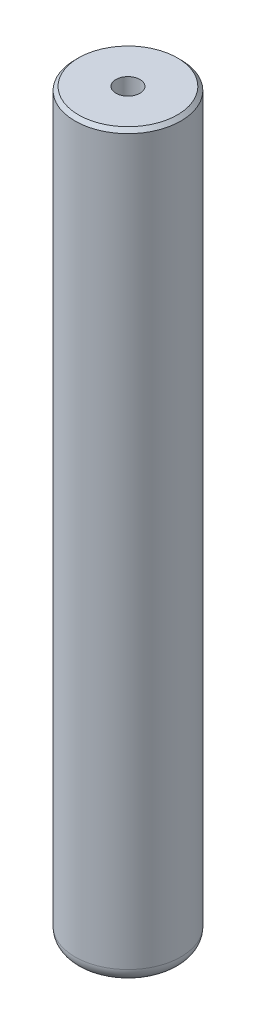
from build123d import *

# Parameters (mm, degrees)
SKETCH1_R                  = 15
BOSS_EXTRUDE1_DEPTH        = 210
FILLET1_R                  = 4
CHAMFER1_SIZE              = 1
M8X1_25_TAPPED_HOLE1_D     = 6.8
M8X1_25_TAPPED_HOLE1_DEPTH = 19.75
M8X1_25_TAPPED_HOLE1_TIP   = 2.042926105


with BuildPart() as part:
    # Sketch1 → Boss-Extrude1 (new body)
    with BuildSketch(Plane(origin=(0, 0, 0), x_dir=(1, 0, 0), z_dir=(0, 1, 0))):
        with Locations(Location((0, 0, 0), (0, 0, 270))):
            Circle(SKETCH1_R)
    extrude(amount=BOSS_EXTRUDE1_DEPTH)

    # Fillet1
    fillet1_edges = [part.edges().sort_by_distance(p)[0] for p in [
        (0, 0, -15),
    ]]
    fillet(fillet1_edges, radius=FILLET1_R)

    # Chamfer1
    chamfer1_edges = [part.edges().sort_by_distance(p)[0] for p in [
        (0, 210, -15),
    ]]
    chamfer(chamfer1_edges, length=CHAMFER1_SIZE)

    # M8x1.25 Tapped Hole1
    with Locations(Plane(origin=(0, 210, 0), x_dir=(1, 0, 0), z_dir=(0, 1, 0))):
        with Locations((0, 0)):
            Hole(M8X1_25_TAPPED_HOLE1_D / 2, depth=M8X1_25_TAPPED_HOLE1_DEPTH)
            with Locations((0, 0, -(M8X1_25_TAPPED_HOLE1_DEPTH + M8X1_25_TAPPED_HOLE1_TIP / 2))):  # 118° drill point
                Cone(0, M8X1_25_TAPPED_HOLE1_D / 2, M8X1_25_TAPPED_HOLE1_TIP, mode=Mode.SUBTRACT)


solid = part.part
